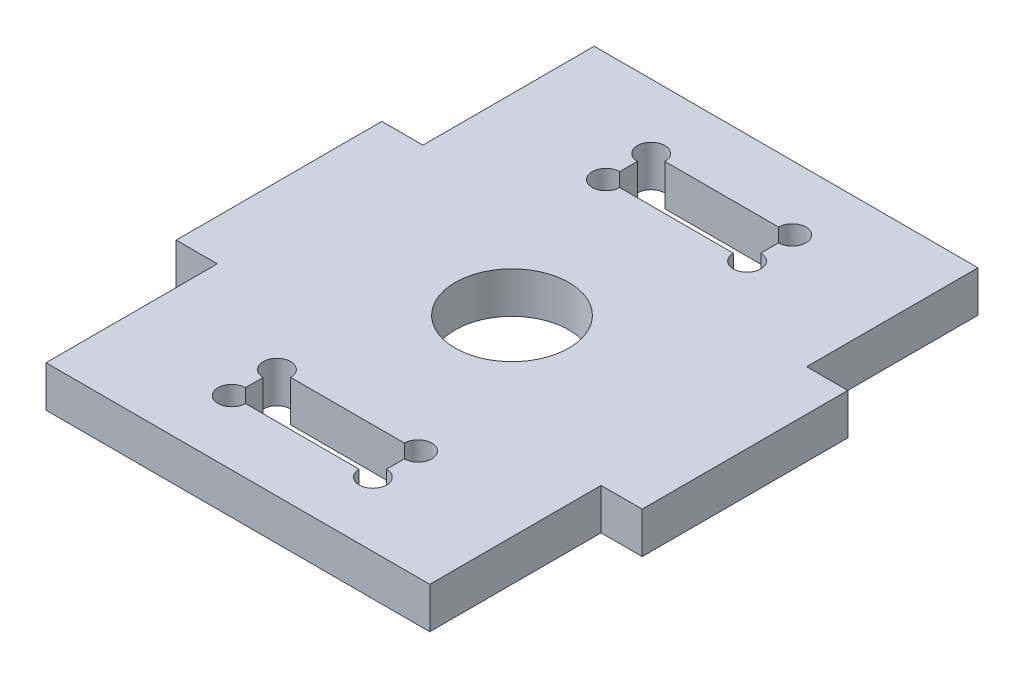
from build123d import *

# Parameters (mm, degrees)
EXTRUDE_1_DEPTH     = 3
SKETCH_3_R          = 4.15
CUT_EXTRUDE_2_DEPTH = 3


with BuildPart() as part:
    # 草图1 → 凸台-拉伸1 (new body)
    with BuildSketch(Plane(origin=(0, 0, 0), x_dir=(1, 0, 0), z_dir=(0, 1, 0))):
        Polygon((14, 20), (-14, 20), (-14, 7.5), (-17, 7.5), (-17, -7.5), (-14, -7.5), (-14, -20), (14, -20), (14, -7.5), (17, -7.5), (17, 7.5), (14, 7.5), align=None)
        with BuildLine():
            ThreePointArc((-5.15, -13), (-5.857106781, -11.292893219), (-4.15, -12))
            Line((-4.15, -12), (4.15, -12))
            ThreePointArc((4.15, -12), (5.857106781, -11.292893219), (5.15, -13))
            Line((5.15, -13), (5.15, -14.3))
            ThreePointArc((5.15, -14.3), (5.857106781, -16.007106781), (4.15, -15.3))
            Line((4.15, -15.3), (-4.15, -15.3))
            ThreePointArc((-4.15, -15.3), (-5.857106781, -16.007106781), (-5.15, -14.3))
            Line((-5.15, -14.3), (-5.15, -13))
        make_face(mode=Mode.SUBTRACT)
        with BuildLine():
            ThreePointArc((-5.15, 14.3), (-5.857106781, 16.007106781), (-4.15, 15.3))
            Line((-4.15, 15.3), (4.15, 15.3))
            ThreePointArc((4.15, 15.3), (5.857106781, 16.007106781), (5.15, 14.3))
            Line((5.15, 14.3), (5.15, 13))
            ThreePointArc((5.15, 13), (5.857106781, 11.292893219), (4.15, 12))
            Line((4.15, 12), (-4.15, 12))
            ThreePointArc((-4.15, 12), (-5.857106781, 11.292893219), (-5.15, 13))
            Line((-5.15, 13), (-5.15, 14.3))
        make_face(mode=Mode.SUBTRACT)
    extrude(amount=EXTRUDE_1_DEPTH)

    # 草图3 → 切除-拉伸2 (cut)
    with BuildSketch(Plane(origin=(0, 3, 0), x_dir=(1, 0, 0), z_dir=(0, 1, 0))):
        with Locations(Location((0, 0, 0), (0, 0, 270))):
            Circle(SKETCH_3_R)
    extrude(amount=-CUT_EXTRUDE_2_DEPTH, mode=Mode.SUBTRACT)


solid = part.part
